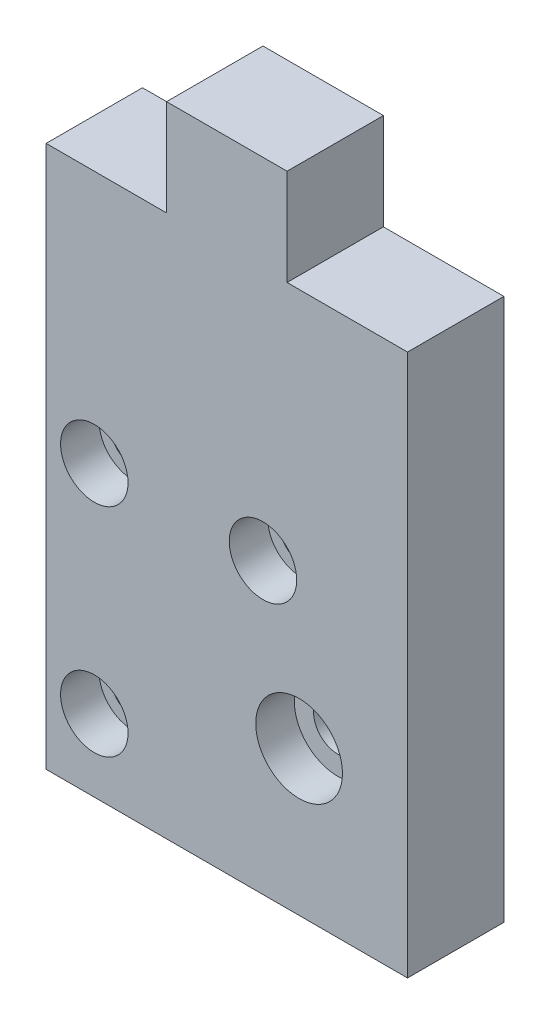
from build123d import *

# Parameters (mm, degrees)
SKETCH1_R           = 2.286
SKETCH1_R_2         = 2.54
BOSS_EXTRUDE1_DEPTH = 10.16
SKETCH7_R           = 3.556
SKETCH7_R_2         = 4.572
CUT_EXTRUDE1_DEPTH  = 4.064
SKETCH3_R           = 1.27
CUT_EXTRUDE2_DEPTH  = 0.508


with BuildPart() as part:
    # Sketch1 → Boss-Extrude1 (new body)
    with BuildSketch(Plane.XY):
        Polygon((0, 57.15), (12.7, 57.15), (12.7, 67.31), (25.4, 67.31), (25.4, 57.15), (38.1, 57.15), (38.1, 0), (0, 0), align=None)
        with Locations((5.08, 7.62)):
            Circle(SKETCH1_R, mode=Mode.SUBTRACT)
        with Locations((5.08, 30.48)):
            Circle(SKETCH1_R, mode=Mode.SUBTRACT)
        with Locations((26.67, 15.24)):
            Circle(SKETCH1_R_2, mode=Mode.SUBTRACT)
        with Locations((22.86, 30.48)):
            Circle(SKETCH1_R, mode=Mode.SUBTRACT)
    extrude(amount=BOSS_EXTRUDE1_DEPTH)

    # Sketch7 → Cut-Extrude1 (cut)
    with BuildSketch(Plane.XY.offset(10.16)):
        with Locations((5.08, 30.48)):
            Circle(SKETCH7_R)
        with Locations((22.86, 30.48)):
            Circle(SKETCH7_R)
        with Locations((5.08, 7.62)):
            Circle(SKETCH7_R)
        with Locations((26.67, 15.24)):
            Circle(SKETCH7_R_2)
    extrude(amount=-CUT_EXTRUDE1_DEPTH, mode=Mode.SUBTRACT)

    # Sketch3 → Cut-Extrude2 (cut)
    with BuildSketch(Plane(origin=(0, 0, 0), x_dir=(-1, 0, 0), z_dir=(0, 0, -1))):
        with Locations((-19.05, 62.23)):
            Circle(SKETCH3_R)
    extrude(amount=-CUT_EXTRUDE2_DEPTH, mode=Mode.SUBTRACT)


solid = part.part
